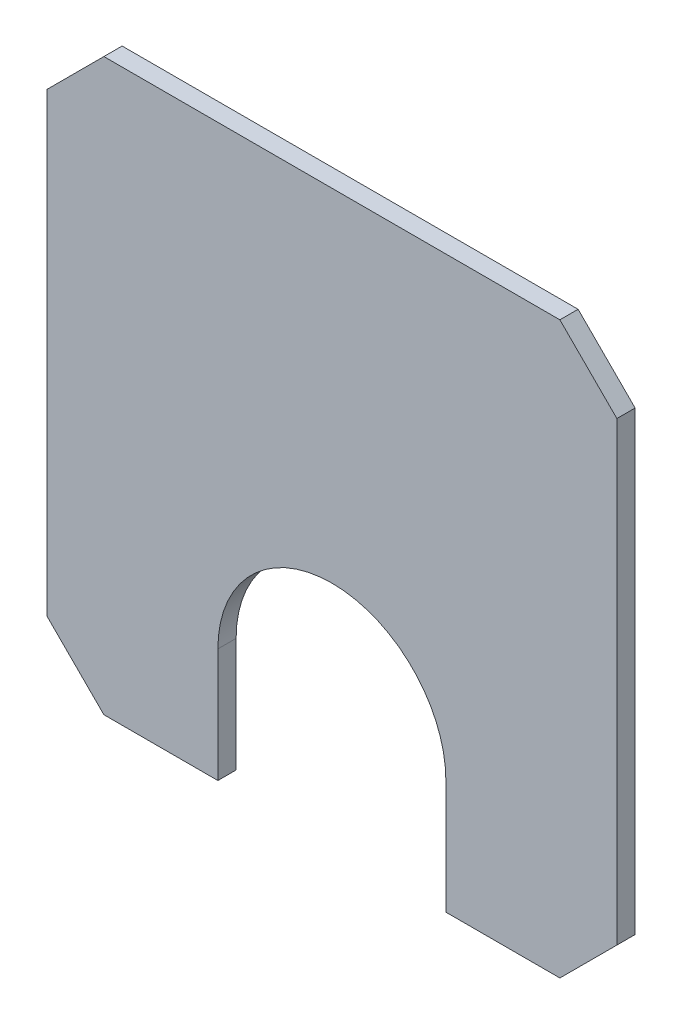
from build123d import *

# Parameters (mm, degrees)
BOARD_DEPTH = 1.599999


with BuildPart() as part:
    # 草圖1 → Board (new body)
    with BuildSketch(Plane.XY):
        with BuildLine():
            Line((14.99999794, 9.99999778), (14.99999794, 0))
            Line((14.99999794, 0), (4.99999762, 0))
            Line((4.99999762, 0), (0, 4.99999762))
            Line((0, 4.99999762), (0, 44.9999989))
            Line((0, 44.9999989), (4.99999762, 49.99999906))
            Line((4.99999762, 49.99999906), (44.9999989, 49.99999906))
            Line((44.9999989, 49.99999906), (49.99999906, 44.9999989))
            Line((49.99999906, 44.9999989), (49.99999906, 4.99999762))
            Line((49.99999906, 4.99999762), (44.9999989, 0))
            Line((44.9999989, 0), (34.99999858, 0))
            Line((34.99999858, 0), (34.99999604, 9.99999778))
            ThreePointArc((34.99999604, 9.99999778), (24.99999699, 19.99999683), (14.99999794, 9.99999778))
        make_face()
    extrude(amount=BOARD_DEPTH)


solid = part.part
